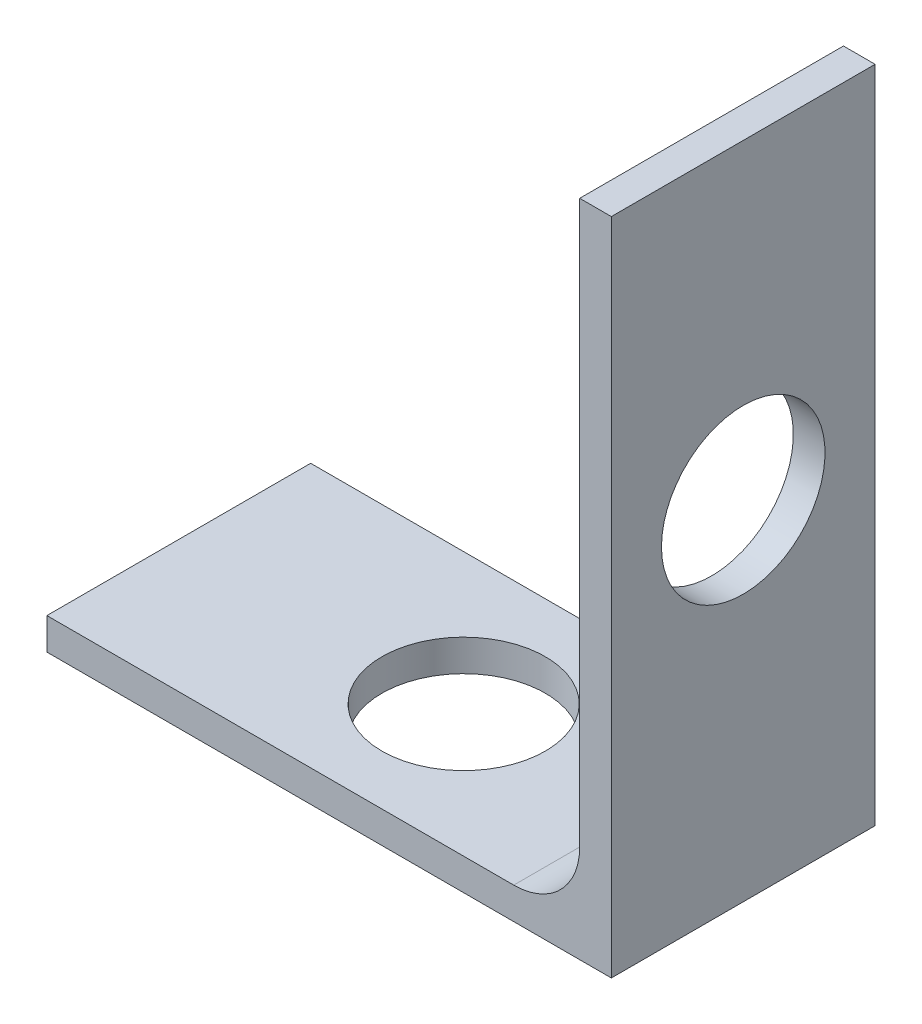
from build123d import *

# Parameters (mm, degrees)
BOSS_EXTRUDE1_DEPTH = 12.7
SKETCH2_R           = 3.937
CUT_EXTRUDE1_DEPTH  = 6.35
SKETCH4_R           = 3.937
CUT_EXTRUDE2_DEPTH  = 6.35
FILLET2_R           = 3.175


with BuildPart() as part:
    # Sketch1 → Boss-Extrude1 (new body)
    with BuildSketch(Plane.XY):
        Polygon((0, 0), (27.178, 0), (27.178, 31.75), (25.654, 31.75), (25.654, 1.524), (0, 1.524), align=None)
    extrude(amount=BOSS_EXTRUDE1_DEPTH)

    # Sketch2 → Cut-Extrude1 (cut)
    with BuildSketch(Plane.ZY.offset(-25.654)):
        with Locations((6.35, 16.764)):
            Circle(SKETCH2_R)
    extrude(amount=-CUT_EXTRUDE1_DEPTH, mode=Mode.SUBTRACT)

    # Sketch4 → Cut-Extrude2 (cut)
    with BuildSketch(Plane(origin=(0, 1.524, 0), x_dir=(1, 0, 0), z_dir=(0, 1, 0))):
        with Locations(Location((13.716, -6.35, 0), (0, 0, 270))):
            Circle(SKETCH4_R)
    extrude(amount=-CUT_EXTRUDE2_DEPTH, mode=Mode.SUBTRACT)

    # Fillet2
    fillet2_edges = [part.edges().sort_by_distance(p)[0] for p in [
        (25.654, 1.524, 6.35),
    ]]
    fillet(fillet2_edges, radius=FILLET2_R)


solid = part.part
